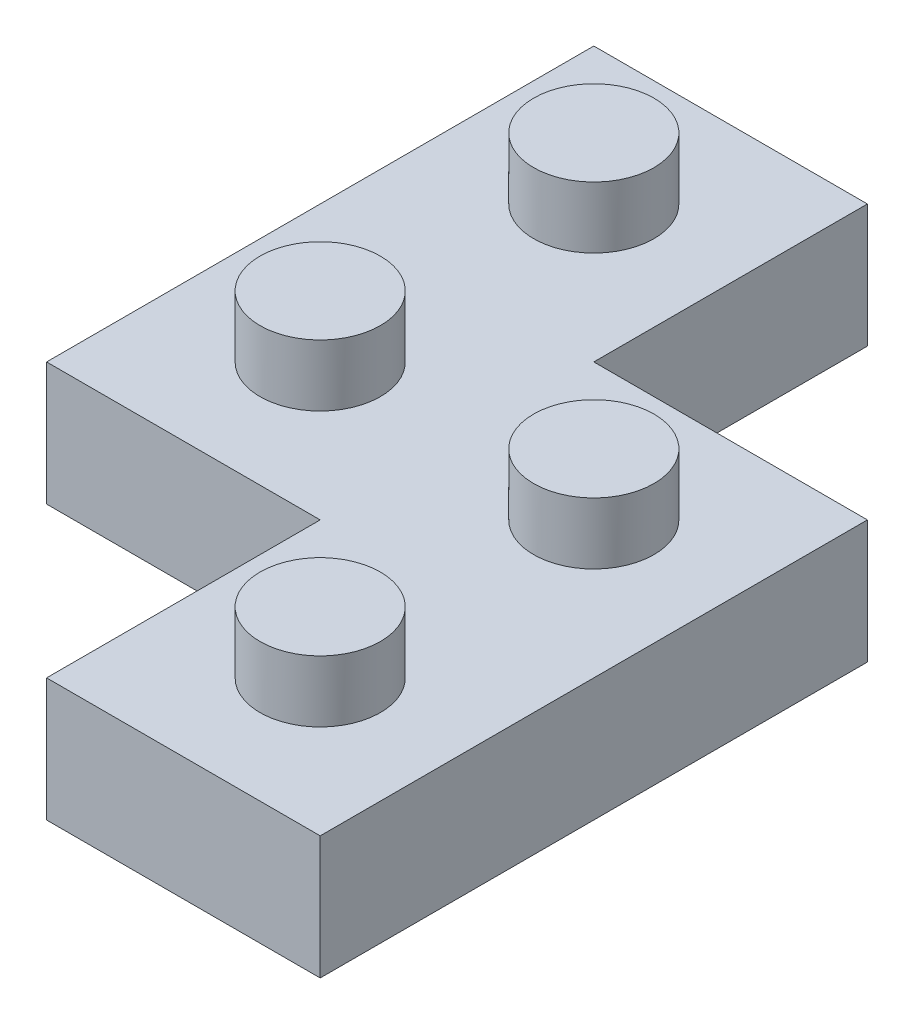
from build123d import *

# Parameters (mm, degrees)
BOSS_EXTRUDE1_DEPTH = 5.715
SKETCH2_R           = 2.794
BOSS_EXTRUDE3_DEPTH = 2.8575


with BuildPart() as part:
    # Sketch1 → Boss-Extrude1 (new body)
    with BuildSketch(Plane(origin=(0, 0, 0), x_dir=(1, 0, 0), z_dir=(0, 1, 0))):
        Polygon((-5.674598366, 20.311212687), (7.025401634, 20.311212687), (7.025401634, 7.611212687), (19.725401634, 7.611212687), (19.725401634, -17.788787313), (7.025401634, -17.788787313), (7.025401634, -5.088787313), (-5.674598366, -5.088787313), align=None)
    extrude(amount=BOSS_EXTRUDE1_DEPTH)

    # Sketch2 → Boss-Extrude3 (add)
    with BuildSketch(Plane(origin=(0, 5.715, 0), x_dir=(1, 0, 0), z_dir=(0, 1, 0))):
        with Locations(Location((0.675401634, 1.261212687, 0), (0, 0, 90))):
            Circle(SKETCH2_R)
        with Locations(Location((13.375401634, 1.261212687, 0), (0, 0, 90))):
            Circle(SKETCH2_R)
        with Locations(Location((0.675401634, 13.961212687, 0), (0, 0, 90))):
            Circle(SKETCH2_R)
        with Locations(Location((13.375401634, -11.438787313, 0), (0, 0, 90))):
            Circle(SKETCH2_R)
    extrude(amount=BOSS_EXTRUDE3_DEPTH)


solid = part.part
